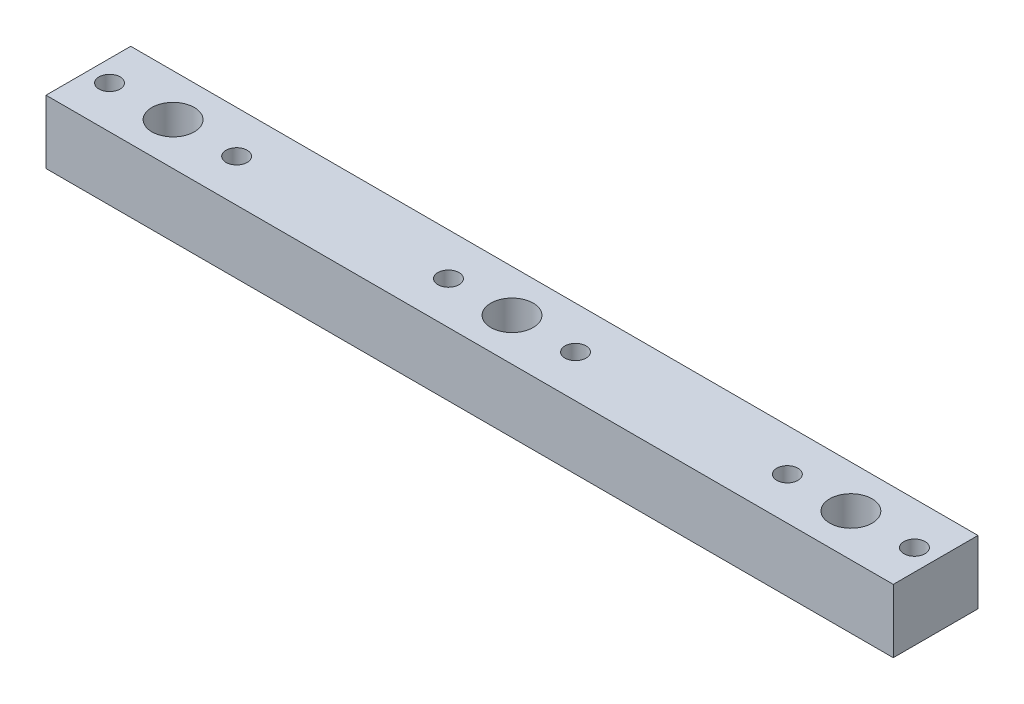
from build123d import *

# Parameters (mm, degrees)
SKETCH1_W           = 200
SKETCH1_H           = 20
SKETCH1_R           = 5
SKETCH1_R_2         = 2.5
BOSS_EXTRUDE1_DEPTH = 15


with BuildPart() as part:
    # Sketch1 → Boss-Extrude1 (new body)
    with BuildSketch(Plane(origin=(0, 0, 0), x_dir=(1, 0, 0), z_dir=(0, 1, 0))):
        with Locations((100, 10)):
            Rectangle(SKETCH1_W, SKETCH1_H)
        with Locations(Location((20, 10, 0), (0, 0, 270))):
            Circle(SKETCH1_R, mode=Mode.SUBTRACT)
        with Locations(Location((35, 10, 0), (0, 0, 270))):
            Circle(SKETCH1_R_2, mode=Mode.SUBTRACT)
        with Locations(Location((5, 10, 0), (0, 0, 270))):
            Circle(SKETCH1_R_2, mode=Mode.SUBTRACT)
        with Locations(Location((180, 10, 0), (0, 0, 270))):
            Circle(SKETCH1_R, mode=Mode.SUBTRACT)
        with Locations(Location((195, 10, 0), (0, 0, 270))):
            Circle(SKETCH1_R_2, mode=Mode.SUBTRACT)
        with Locations(Location((165, 10, 0), (0, 0, 270))):
            Circle(SKETCH1_R_2, mode=Mode.SUBTRACT)
        with Locations(Location((100, 10, 0), (0, 0, 270))):
            Circle(SKETCH1_R, mode=Mode.SUBTRACT)
        with Locations(Location((115, 10, 0), (0, 0, 270))):
            Circle(SKETCH1_R_2, mode=Mode.SUBTRACT)
        with Locations(Location((85, 10, 0), (0, 0, 270))):
            Circle(SKETCH1_R_2, mode=Mode.SUBTRACT)
    extrude(amount=BOSS_EXTRUDE1_DEPTH)


solid = part.part
